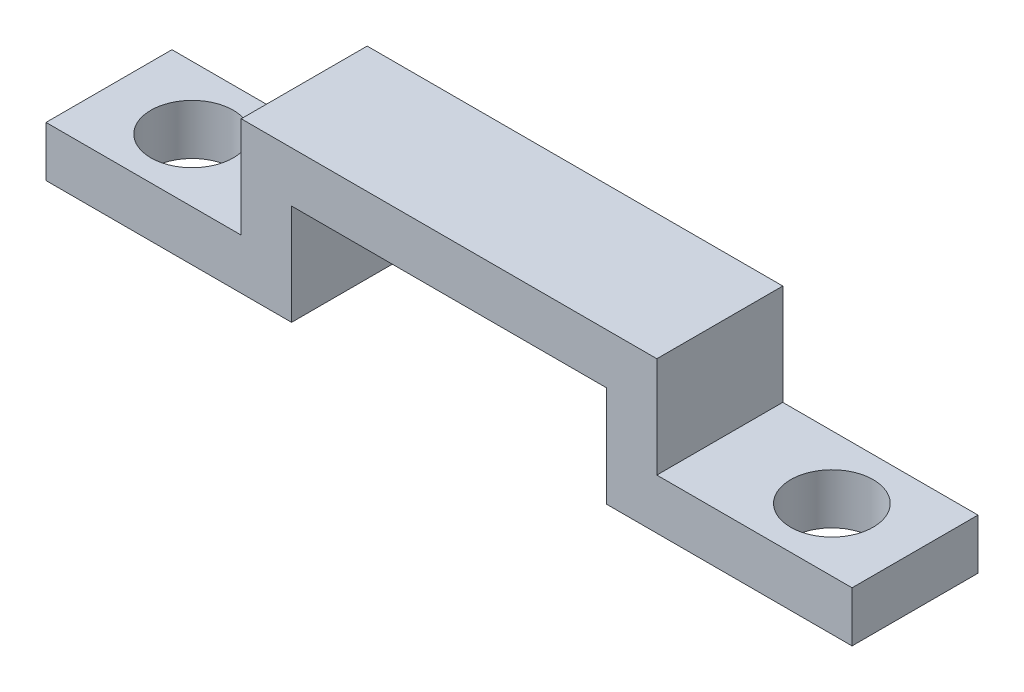
from build123d import *

# Parameters (mm, degrees)
BOSS_EXTRUDE1_DEPTH = 5
SKETCH2_R           = 1.6383
CUT_EXTRUDE1_DEPTH  = 5


with BuildPart() as part:
    # Sketch1 → Boss-Extrude1 (new body)
    with BuildSketch(Plane.XY):
        Polygon((-16, 0), (-6.25, 0), (-6.25, 4), (0, 4), (6.25, 4), (6.25, 0), (16, 0), (16, 2), (8.25, 2), (8.25, 6), (0, 6), (-8.25, 6), (-8.25, 2), (-16, 2), align=None)
    extrude(amount=BOSS_EXTRUDE1_DEPTH)

    # Sketch2 → Cut-Extrude1 (cut)
    with BuildSketch(Plane(origin=(0, 2, 0), x_dir=(1, 0, 0), z_dir=(0, 1, 0))):
        with Locations(Location((-12.7, -2.5, 0), (0, 0, 270))):
            Circle(SKETCH2_R)
        with Locations(Location((12.7, -2.5, 0), (0, 0, 270))):
            Circle(SKETCH2_R)
    extrude(amount=-CUT_EXTRUDE1_DEPTH, mode=Mode.SUBTRACT)


solid = part.part
